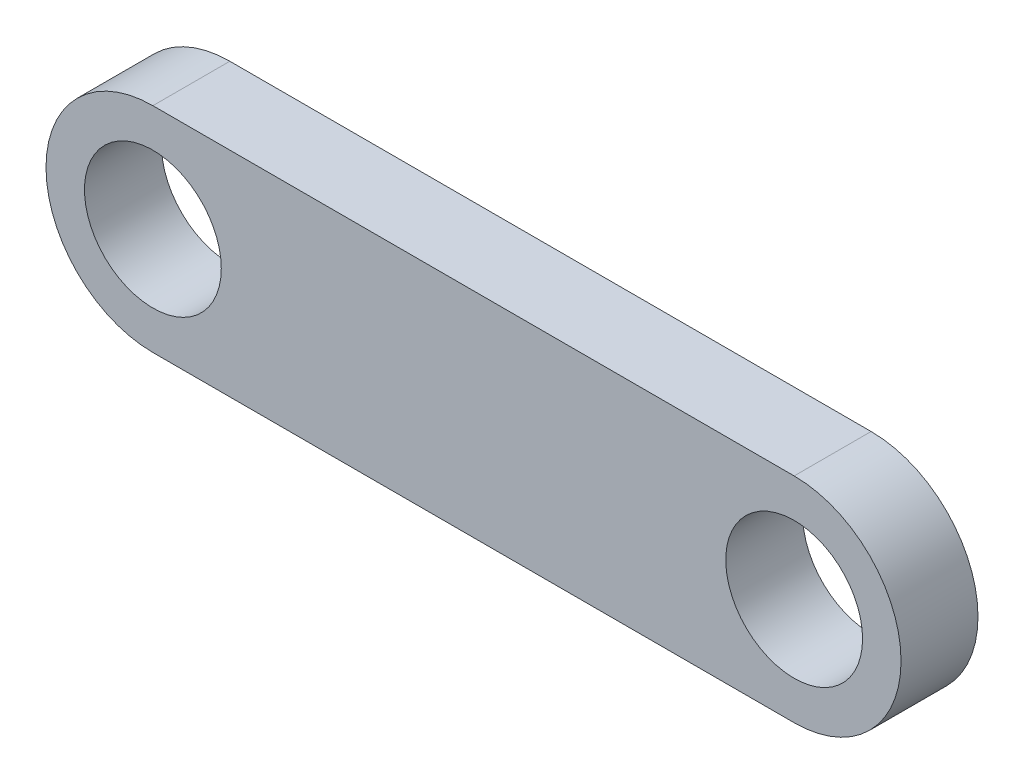
from build123d import *

# Parameters (mm, degrees)
BOSS_EXTRUDE2_DEPTH      = 0.9
BOSS_EXTRUDE2_DEPTH_BACK = 0.9
SKETCH1_R                = 1.6


with BuildPart() as part:
    # Sketch1 → Boss-Extrude2 (new, two sides: drawn at the far end of the back side and taken through both)
    with BuildSketch(Plane.XY.offset(-BOSS_EXTRUDE2_DEPTH_BACK)):
        with BuildLine():
            Line((7.5, 3.5), (-7.5, 3.5))
            ThreePointArc((-7.5, 3.5), (-10, 1), (-7.5, -1.5))
            Line((-7.5, -1.5), (7.5, -1.5))
            ThreePointArc((7.5, -1.5), (10, 1), (7.5, 3.5))
        make_face()
        with Locations((7.5, 1)):
            Circle(SKETCH1_R, mode=Mode.SUBTRACT)
        with Locations((-7.5, 1)):
            Circle(SKETCH1_R, mode=Mode.SUBTRACT)
    extrude(amount=BOSS_EXTRUDE2_DEPTH + BOSS_EXTRUDE2_DEPTH_BACK)


solid = part.part
